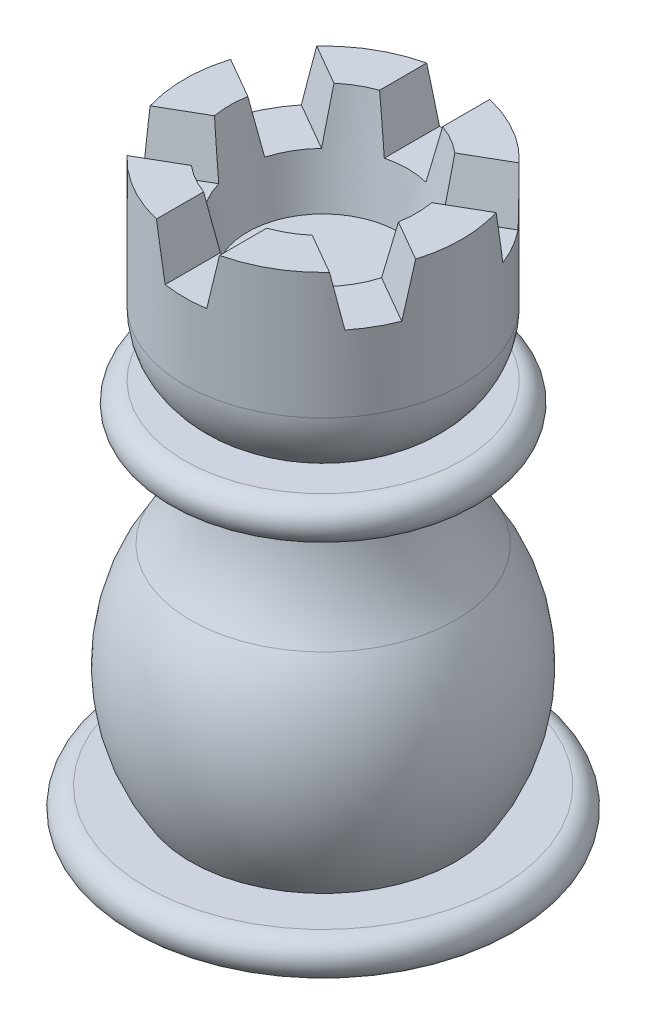
from build123d import *

# Parameters (mm, degrees)
CUT_EXTRUDE1_DEPTH = 51.955863315
CIRPATTERN1_COUNT  = 6


with BuildPart() as part:
    # Sketch1 → Revolve1 (revolve)
    with BuildSketch(Plane.XY):
        with BuildLine():
            Line((0, 0), (14, 0))
            ThreePointArc((14, 0), (15.5, 1.5), (14, 3))
            Line((14, 3), (10.5, 3))
            ThreePointArc((10.5, 3), (13, 11.291638169), (10.499915764, 19.583250941))
            ThreePointArc((10.499915764, 19.583250941), (8.648748728, 23.510719191), (8, 27.803847577))
            Line((8, 27.803847577), (11, 27.803847577))
            ThreePointArc((11, 27.803847577), (12.5, 29.303847577), (11, 30.803847577))
            Line((11, 30.803847577), (8, 30.803847577))
            ThreePointArc((8, 30.803847577), (10.196152423, 33), (11, 36))
            Line((11, 36), (11, 46))
            Line((11, 46), (7.410615846, 46))
            Line((7.410615846, 46), (6, 38))
            Line((6, 38), (0, 38))
            Line((0, 38), (0, 0))
        make_face()
    revolve(axis=Axis((0, 0, 0), (0, 1, 0)))

    # Sketch2 → Cut-Extrude1 (cut, through all)
    with BuildSketch(Plane.XY):
        Polygon((1.649773753, 42), (2.5, 46), (0, 46), (0, 42), align=None)
        Polygon((0, 42), (0, 46), (-2.5, 46), (-1.649773753, 42), align=None)
    cut_extrude1 = extrude(amount=-CUT_EXTRUDE1_DEPTH, mode=Mode.SUBTRACT)

    # CirPattern1: Cut-Extrude1 ×6 about axis
    cirpattern1_axis = Axis((0, 0, 0), (0, 1, 0))
    for i in range(1, CIRPATTERN1_COUNT):
        add(cut_extrude1.rotate(cirpattern1_axis, i * 360 / CIRPATTERN1_COUNT), mode=Mode.SUBTRACT)


solid = part.part
